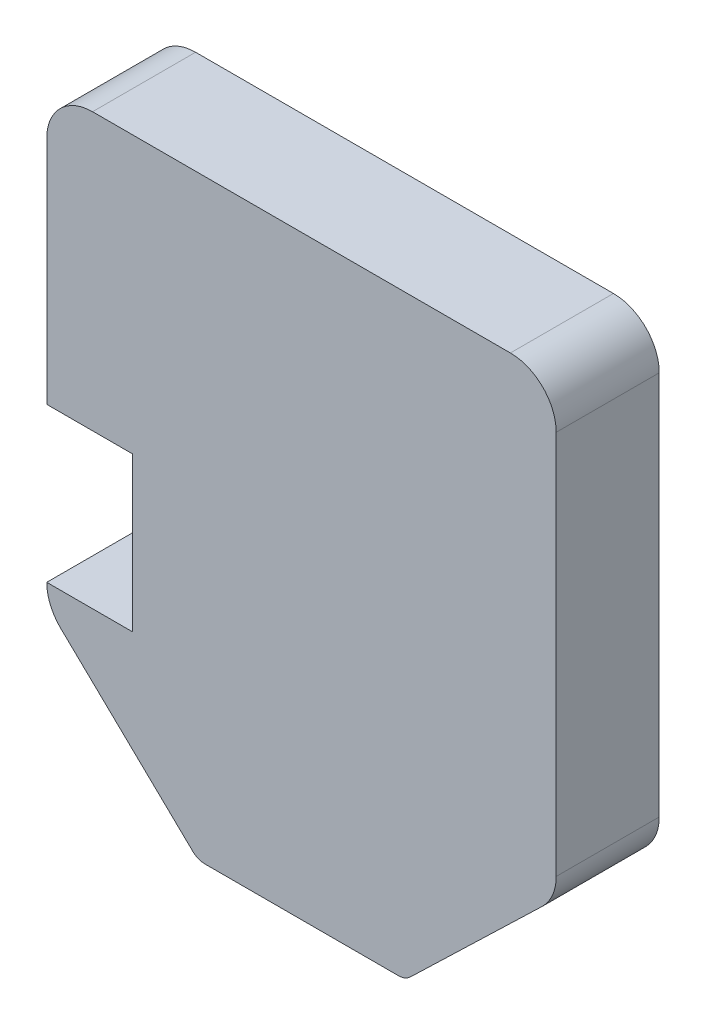
from build123d import *

# Parameters (mm, degrees)
PALM_BODY_DEPTH     = 9
SKETCH7_W           = 18
SKETCH7_H           = 26.918715159
BOSS_EXTRUDE1_DEPTH = 15


with BuildPart() as part:
    # Palm_sketch → Palm_Body (new, symmetric)
    with BuildSketch(Plane.XY):
        with BuildLine():
            Line((-36.5, 78.60257579), (36.5, 78.60257579))
            ThreePointArc((36.5, 78.60257579), (42.156854249, 76.259430039), (44.5, 70.60257579))
            Line((44.5, 70.60257579), (44.5, 3.401763707))
            ThreePointArc((44.5, 3.401763707), (43.86206295, 0.271263888), (42.04999272, -2.359970476))
            Line((42.04999272, -2.359970476), (19.004994037, -24.558074529))
            ThreePointArc((19.004994037, -24.558074529), (18.045809386, -25.179685068), (16.923746767, -25.39742421))
            Line((16.923746767, -25.39742421), (-16.891594266, -25.39742421))
            ThreePointArc((-16.891594266, -25.39742421), (-18.012780844, -25.180038208), (-18.971480575, -24.55938465))
            Line((-18.971480575, -24.55938465), (-42.04636349, -2.360489531))
            ThreePointArc((-42.04636349, -2.360489531), (-43.861076957, 0.27192072), (-44.5, 3.404738308))
            Line((-44.5, 3.404738308), (-44.5, 70.60257579))
            ThreePointArc((-44.5, 70.60257579), (-42.156854249, 76.259430039), (-36.5, 78.60257579))
        make_face()
    extrude(amount=PALM_BODY_DEPTH, both=True)


with BuildPart() as body_2:
    # Sketch7 → Boss-Extrude1 (new body)
    with BuildSketch(Plane.ZY.offset(44.5)):
        with Locations((0, 16.864095887)):
            Rectangle(SKETCH7_W, SKETCH7_H)
    extrude(amount=-BOSS_EXTRUDE1_DEPTH)


with BuildPart() as part_1:
    add(part.part)

    # Combine1: cut body 2
    add(body_2.part, mode=Mode.SUBTRACT)


solid = part_1.part
